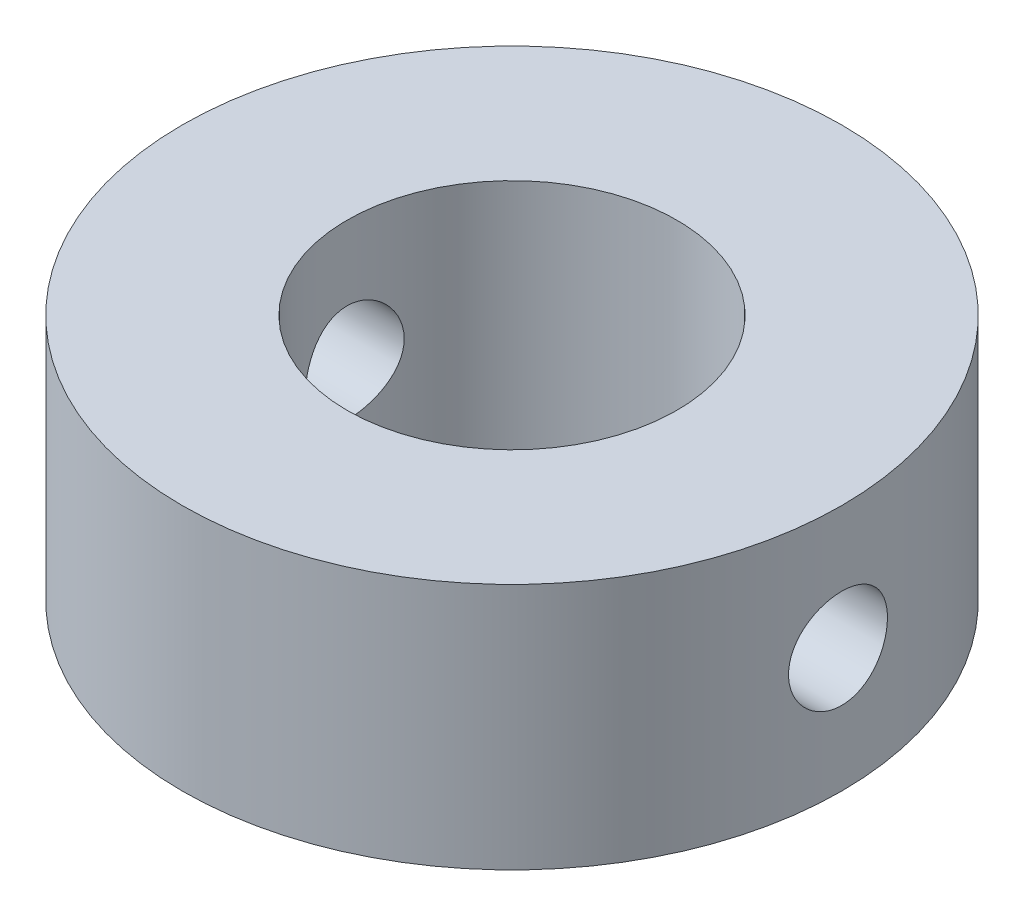
from build123d import *

# Parameters (mm, degrees)
SKETCH1_R               = 10
SKETCH1_R_2             = 5
BOSS_EXTRUDE1_DEPTH     = 7.5
CUT_EXTRUDE1_DEPTH      = 20.5
CUT_EXTRUDE1_DEPTH_BACK = 19
SKETCH2_R               = 1.5


with BuildPart() as part:
    # Sketch1 → Boss-Extrude1 (new body)
    with BuildSketch(Plane(origin=(0, 0, 0), x_dir=(1, 0, 0), z_dir=(0, 1, 0))):
        with Locations(Location((0, 0, 0), (0, 0, 270))):
            Circle(SKETCH1_R)
        with Locations(Location((0, 0, 0), (0, 0, 270))):
            Circle(SKETCH1_R_2, mode=Mode.SUBTRACT)
    extrude(amount=BOSS_EXTRUDE1_DEPTH)

    # Sketch2 → Cut-Extrude1 (cut, two sides: drawn at the far end of the back side and taken through both)
    with BuildSketch(Plane(origin=(0, 0, 0), x_dir=(0, 0, -1), z_dir=(1, 0, 0)).offset(-CUT_EXTRUDE1_DEPTH_BACK)):
        with Locations((0, 3.75)):
            Circle(SKETCH2_R)
    extrude(amount=CUT_EXTRUDE1_DEPTH + CUT_EXTRUDE1_DEPTH_BACK, mode=Mode.SUBTRACT)


solid = part.part
